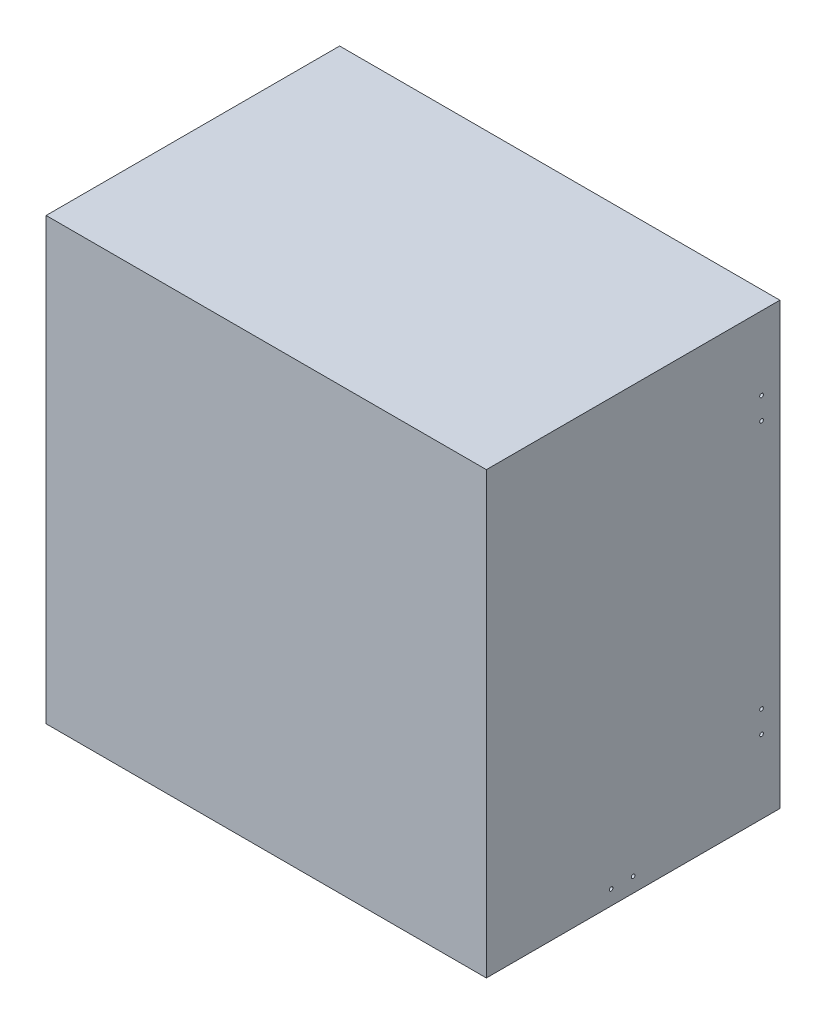
from build123d import *

# Parameters (mm, degrees)
SKETCH2_W           = 600
SKETCH2_H           = 400
BOSS_EXTRUDE1_DEPTH = 600
SHELL1_T            = -50
SKETCH3_R           = 2.5
CUT_EXTRUDE1_DEPTH  = 872.779788708
SKETCH4_R           = 2.5
CUT_EXTRUDE2_DEPTH  = 275
LPATTERN1_COUNT     = 8
LPATTERN1_PITCH     = 50
SKETCH5_R           = 2.5
CUT_EXTRUDE3_DEPTH  = 872.779788708


with BuildPart() as part:
    # Sketch2 → Boss-Extrude1 (new body)
    with BuildSketch(Plane(origin=(0, 0, 0), x_dir=(1, 0, 0), z_dir=(0, 1, 0))):
        Rectangle(SKETCH2_W, SKETCH2_H)
    extrude(amount=BOSS_EXTRUDE1_DEPTH)

    # Shell1
    shell1_openings = [part.faces().sort_by_distance(p)[0] for p in [
        (0, 300, -200),
    ]]
    offset(amount=SHELL1_T, openings=shell1_openings, kind=Kind.INTERSECTION)

    # Sketch3 → Cut-Extrude1 (cut, through all)
    with BuildSketch(Plane.ZY.offset(300)):
        with Locations((-175, 100)):
            Circle(SKETCH3_R)
        with Locations((-175, 130)):
            Circle(SKETCH3_R)
        with Locations((-175, 470)):
            Circle(SKETCH3_R)
        with Locations((-175, 500)):
            Circle(SKETCH3_R)
    extrude(amount=-CUT_EXTRUDE1_DEPTH, mode=Mode.SUBTRACT)

    # Sketch4 → Cut-Extrude2 (cut, symmetric)
    with BuildSketch(Plane(origin=(0, 0, 0), x_dir=(0, 0, -1), z_dir=(1, 0, 0))):
        with Locations((-105, 130)):
            Circle(SKETCH4_R)
        with Locations((145, 130)):
            Circle(SKETCH4_R)
    cut_extrude2 = extrude(amount=CUT_EXTRUDE2_DEPTH, both=True, mode=Mode.SUBTRACT)

    # LPattern1: Cut-Extrude2 ×8
    with Locations(*[(0, i * LPATTERN1_PITCH, 0) for i in range(1, LPATTERN1_COUNT)]):
        add(cut_extrude2, mode=Mode.SUBTRACT)

    # Sketch5 → Cut-Extrude3 (cut, through all)
    with BuildSketch(Plane.ZY.offset(300)):
        with Locations((0, 20)):
            Circle(SKETCH5_R)
        with Locations((30, 20)):
            Circle(SKETCH5_R)
    extrude(amount=-CUT_EXTRUDE3_DEPTH, mode=Mode.SUBTRACT)


solid = part.part
